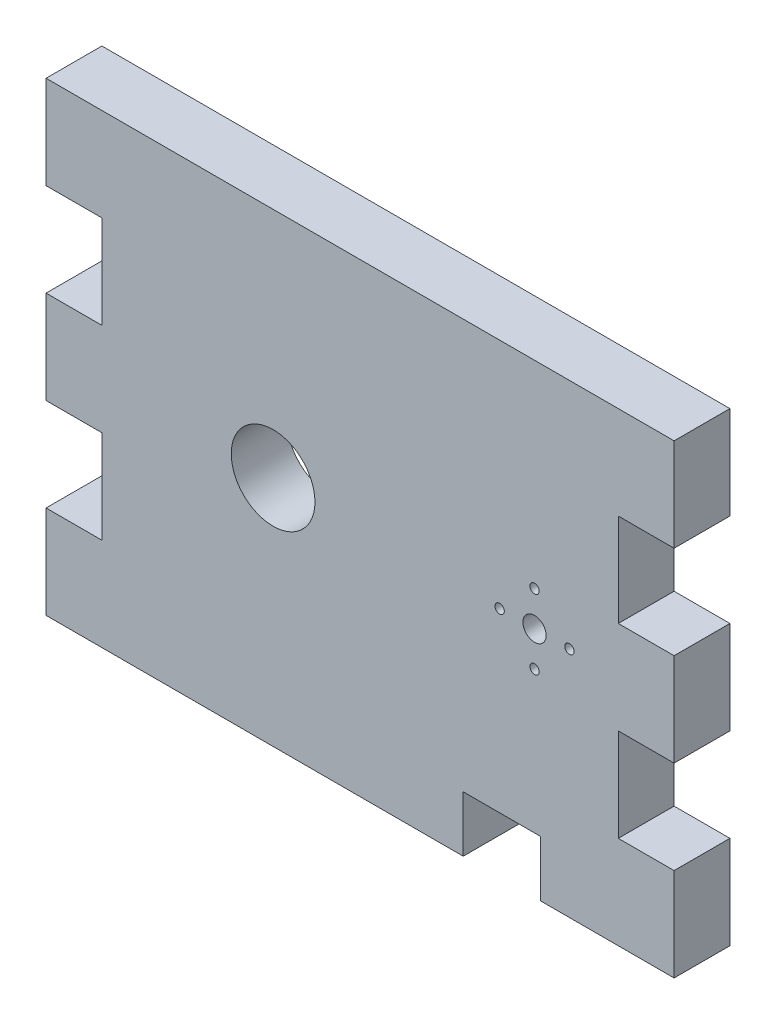
from build123d import *

# Parameters (mm, degrees)
SKETCH1_W           = 171.45
SKETCH1_H           = 127
BOSS_EXTRUDE1_DEPTH = 15.24
SKETCH5_W           = 15.24
SKETCH5_H           = 25.4
CUT_EXTRUDE1_DEPTH  = 15.24
SKETCH11_R          = 11.43
CUT_EXTRUDE3_DEPTH  = 15.24
SKETCH12_R          = 3.175
SKETCH12_R_2        = 1.27
CUT_EXTRUDE4_DEPTH  = 15.24
SKETCH7_W           = 21.166666666
SKETCH7_H           = 15.24
CUT_EXTRUDE5_DEPTH  = 15.24


with BuildPart() as part:
    # Sketch1 → Boss-Extrude1 (new body)
    with BuildSketch(Plane.XY):
        with Locations((85.725, 63.5)):
            Rectangle(SKETCH1_W, SKETCH1_H)
    extrude(amount=BOSS_EXTRUDE1_DEPTH)

    # Sketch5 → Cut-Extrude1 (cut)
    with BuildSketch(Plane.XY.offset(15.24)):
        with Locations((7.62, 88.9)):
            Rectangle(SKETCH5_W, SKETCH5_H)
        with Locations((7.62, 38.1)):
            Rectangle(SKETCH5_W, SKETCH5_H)
        with Locations((163.83, 88.9)):
            Rectangle(SKETCH5_W, SKETCH5_H)
        with Locations((163.83, 38.1)):
            Rectangle(SKETCH5_W, SKETCH5_H)
    extrude(amount=-CUT_EXTRUDE1_DEPTH, mode=Mode.SUBTRACT)

    # Sketch11 → Cut-Extrude3 (cut)
    with BuildSketch(Plane.XY.offset(15.24)):
        with Locations((61.976, 63.5)):
            Circle(SKETCH11_R)
    extrude(amount=-CUT_EXTRUDE3_DEPTH, mode=Mode.SUBTRACT)

    # Sketch12 → Cut-Extrude4 (cut)
    with BuildSketch(Plane.XY.offset(15.24)):
        with Locations((133.35, 63.5)):
            Circle(SKETCH12_R)
        with Locations((133.35, 73.025)):
            Circle(SKETCH12_R_2)
        with Locations((142.875, 63.5)):
            Circle(SKETCH12_R_2)
        with Locations((133.35, 53.975)):
            Circle(SKETCH12_R_2)
        with Locations((123.825, 63.5)):
            Circle(SKETCH12_R_2)
    extrude(amount=-CUT_EXTRUDE4_DEPTH, mode=Mode.SUBTRACT)

    # Sketch7 → Cut-Extrude5 (cut)
    with BuildSketch(Plane.XY.offset(15.24)):
        with Locations((124.46, 7.62)):
            Rectangle(SKETCH7_W, SKETCH7_H)
    extrude(amount=-CUT_EXTRUDE5_DEPTH, mode=Mode.SUBTRACT)


solid = part.part
